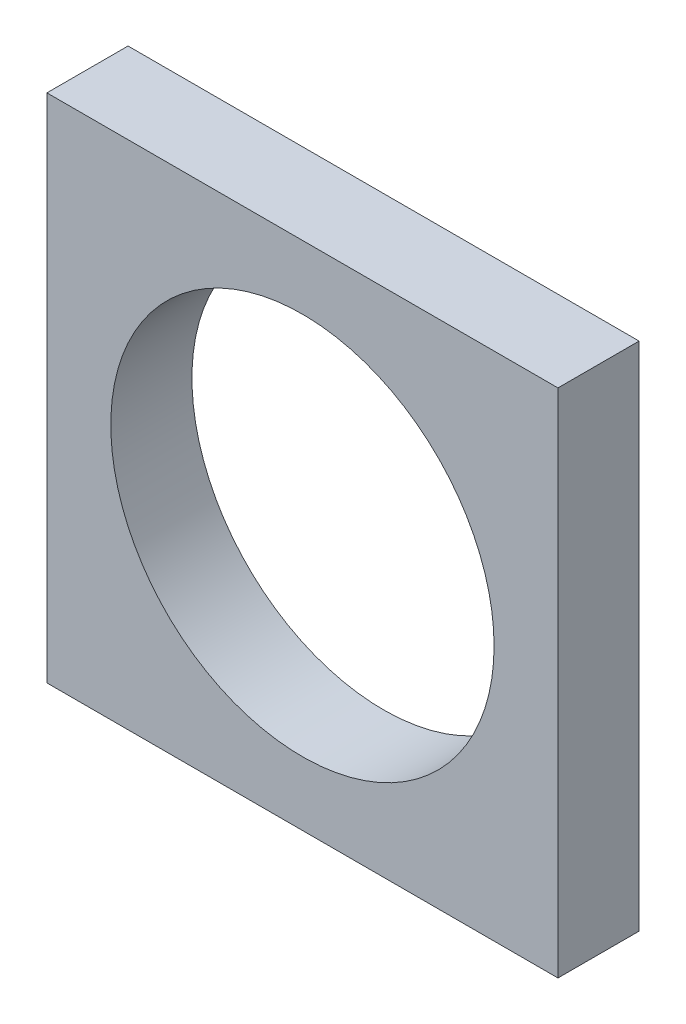
from build123d import *

# Parameters (mm, degrees)
SKETCH1_W           = 20
SKETCH1_H           = 20
BOSS_EXTRUDE1_DEPTH = 3.175
SKETCH3_R           = 7.5
CUT_EXTRUDE1_DEPTH  = 3.175


with BuildPart() as part:
    # Sketch1 → Boss-Extrude1 (new body)
    with BuildSketch(Plane.XY):
        with Locations((10, 10)):
            Rectangle(SKETCH1_W, SKETCH1_H)
    extrude(amount=BOSS_EXTRUDE1_DEPTH)

    # Sketch3 → Cut-Extrude1 (cut)
    with BuildSketch(Plane.XY.offset(3.175)):
        with Locations((10, 10)):
            Circle(SKETCH3_R)
    extrude(amount=-CUT_EXTRUDE1_DEPTH, mode=Mode.SUBTRACT)


solid = part.part
